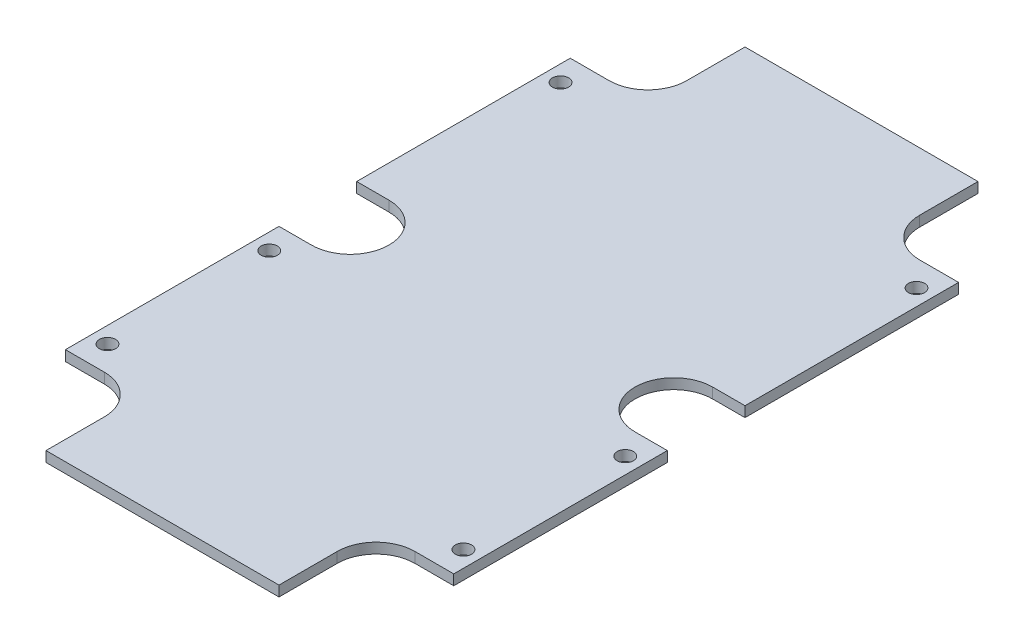
from build123d import *

# Parameters (mm, degrees)
BOSS_EXTRUDE3_DEPTH = 1.6
SKETCH1_9_R         = 1.25
CUT_EXTRUDE2_DEPTH  = 1.6


with BuildPart() as part:
    # Sketch1 → Boss-Extrude3 (new body)
    with BuildSketch(Plane(origin=(0, 0, 0), x_dir=(1, 0, 0), z_dir=(0, 1, 0))):
        with BuildLine():
            Line((-30, -39), (-30, -6))
            Line((-30, -6), (-25, -6))
            ThreePointArc((-25, -6), (-19, 0), (-25, 6))
            Line((-25, 6), (-30, 6))
            Line((-30, 6), (-30, 39))
            Line((-30, 39), (-24, 39))
            ThreePointArc((-24, 39), (-19.757359313, 40.757359313), (-18, 45))
            Line((-18, 45), (-18, 54))
            Line((-18, 54), (18, 54))
            Line((18, 54), (18, 45))
            ThreePointArc((18, 45), (19.757359313, 40.757359313), (24, 39))
            Line((24, 39), (30, 39))
            Line((30, 39), (30, 6))
            Line((30, 6), (25, 6))
            ThreePointArc((25, 6), (19, 0), (25, -6))
            Line((25, -6), (30, -6))
            Line((30, -6), (30, -39))
            Line((30, -39), (24, -39))
            ThreePointArc((24, -39), (19.757359313, -40.757359313), (18, -45))
            Line((18, -45), (18, -54))
            Line((18, -54), (-18, -54))
            Line((-18, -54), (-18, -45))
            ThreePointArc((-18, -45), (-19.757359313, -40.757359313), (-24, -39))
            Line((-24, -39), (-30, -39))
        make_face()
    extrude(amount=BOSS_EXTRUDE3_DEPTH)

    # Sketch1<9> → Cut-Extrude2 (cut)
    with BuildSketch(Plane(origin=(0, 0, 0), x_dir=(1, 0, 0), z_dir=(0, 1, 0))):
        with Locations((-27.5, -35)):
            Circle(SKETCH1_9_R)
        with Locations((-27.5, -10)):
            Circle(SKETCH1_9_R)
        with Locations((27.5, -10)):
            Circle(SKETCH1_9_R)
        with Locations((27.5, -35)):
            Circle(SKETCH1_9_R)
        with Locations((27.5, 35)):
            Circle(SKETCH1_9_R)
        with Locations((-27.5, 35)):
            Circle(SKETCH1_9_R)
    extrude(amount=CUT_EXTRUDE2_DEPTH, mode=Mode.SUBTRACT)


solid = part.part
